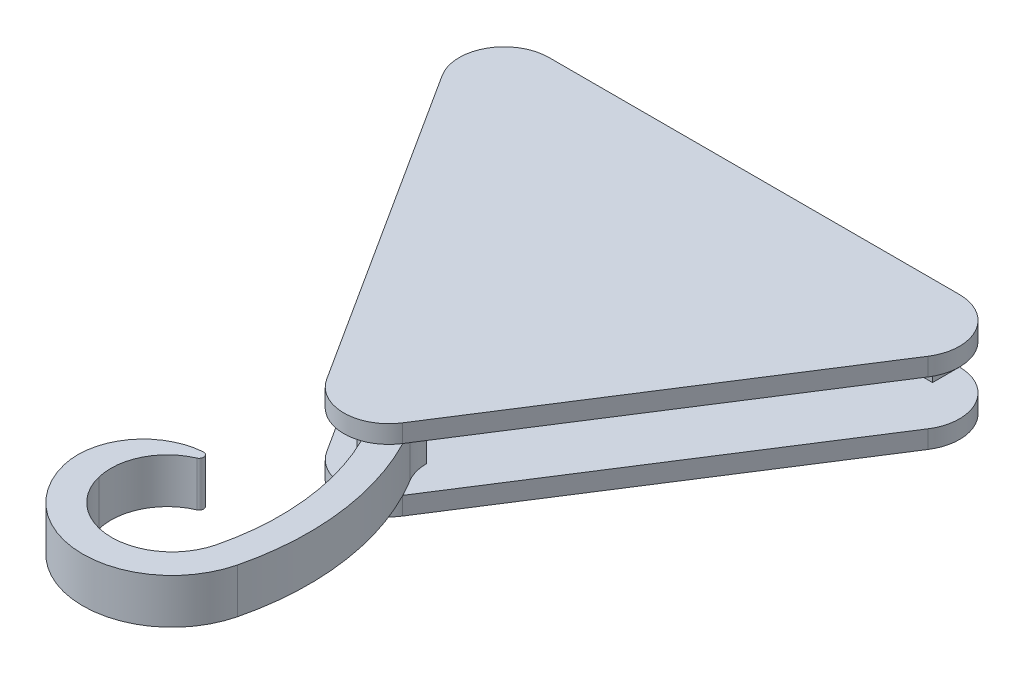
from build123d import *

# Parameters (mm, degrees)
BOSS_EXTRUDE1_DEPTH = 20
BOSS_EXTRUDE2_DEPTH = 50
LPATTERN1_COUNT     = 2
LPATTERN1_PITCH     = 70
BOSS_EXTRUDE3_REACH = 776.125
SKETCH3_W           = 457.273423362
SKETCH3_H           = 30


with BuildPart() as part:
    # Sketch1 → Boss-Extrude1 (new body)
    with BuildSketch(Plane(origin=(0, 0, 0), x_dir=(1, 0, 0), z_dir=(0, 1, 0))):
        with BuildLine():
            Line((-228.636711681, 0), (228.636711681, 0))
            ThreePointArc((228.636711681, 0), (272.498051384, -25.996190313), (270.750281714, -76.952684821))
            Line((270.750281714, -76.952684821), (42.113570033, -434.197546823))
            ThreePointArc((42.113570033, -434.197546823), (0, -457.244862002), (-42.113570033, -434.197546823))
            Line((-42.113570033, -434.197546823), (-270.750281714, -76.952684821))
            ThreePointArc((-270.750281714, -76.952684821), (-272.498051384, -25.996190313), (-228.636711681, 0))
        make_face()
    boss_extrude1 = extrude(amount=BOSS_EXTRUDE1_DEPTH)

    # Sketch2 → Boss-Extrude2 (add)
    with BuildSketch(Plane(origin=(0, 20, 0), x_dir=(1, 0, 0), z_dir=(0, 1, 0))):
        with BuildLine():
            Line((25, -407.244862002), (25, -389.984284025))
            ThreePointArc((25, -389.984284025), (26.855525993, -403.479083858), (32.284384902, -415.972285617))
            ThreePointArc((32.284384902, -415.972285617), (72.447700685, -525.93026828), (67.470990768, -642.887877029))
            ThreePointArc((67.470990768, -642.887877029), (-29.198926208, -718.840220009), (-125.868843184, -642.887877029))
            ThreePointArc((-125.868843184, -642.887877029), (-114.073381051, -582.901412142), (-60.734106459, -553.027833807))
            ThreePointArc((-60.734106459, -553.027833807), (-55.492909619, -556.813918342), (-58.368713355, -562.604801979))
            ThreePointArc((-58.368713355, -562.604801979), (-89.779262863, -592.310875601), (-94.604026186, -635.273593035))
            ThreePointArc((-94.604026186, -635.273593035), (-29.198926208, -686.661560891), (36.20617377, -635.273593035))
            ThreePointArc((36.20617377, -635.273593035), (41.462255839, -536.500850943), (10.508220975, -442.556565834))
            ThreePointArc((10.508220975, -442.556565834), (5.87000649, -430.876676247), (4.290677946, -418.409175466))
            Line((4.290677946, -418.409175466), (4.290677946, -431.873911573))
            ThreePointArc((4.290677946, -431.873911573), (-19.134614559, -391.155532443), (25, -407.244862002))
        make_face()
    extrude(amount=BOSS_EXTRUDE2_DEPTH)

    # LPattern1: Boss-Extrude1 ×2
    with Locations(*[(0, i * LPATTERN1_PITCH, 0) for i in range(1, LPATTERN1_COUNT)]):
        add(boss_extrude1)

    # Sketch3 → Boss-Extrude3 (add, up to next)
    with BuildSketch(Plane(origin=(0, 20, 0), x_dir=(1, 0, 0), z_dir=(0, 1, 0)), mode=Mode.PRIVATE) as boss_extrude3_sk1:
        with Locations((0, -15)):
            Rectangle(SKETCH3_W, SKETCH3_H)
    boss_extrude3_tool1 = extrude(boss_extrude3_sk1.sketch, amount=BOSS_EXTRUDE3_REACH, mode=Mode.PRIVATE) - part.part
    add(boss_extrude3_tool1.solids().sort_by_distance((0, 20, 15))[0])


solid = part.part
